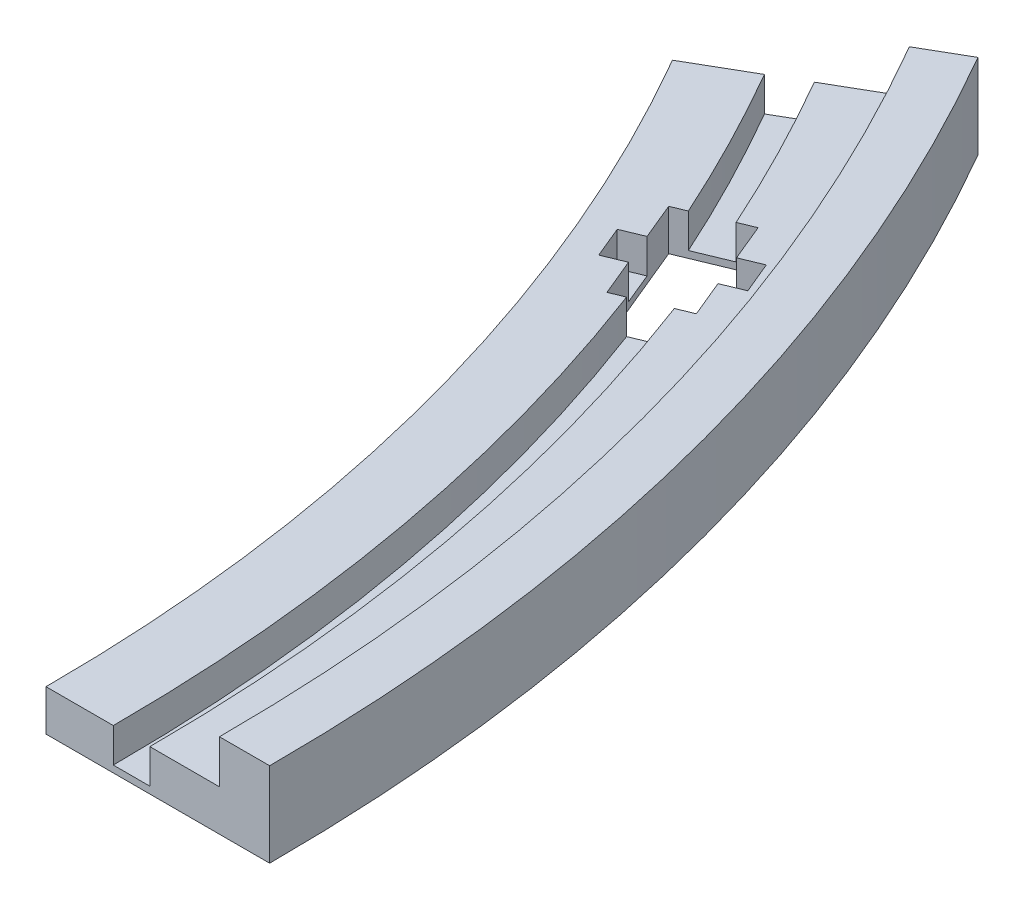
from build123d import *

# Parameters (mm, degrees)
AUFSATZ_LINEAR_AUSTRAGEN1_DEPTH = 3.6
SCHNITT_LINEAR_AUSTRAGEN1_DEPTH = 3
SCHNITT_LINEAR_AUSTRAGEN2_DEPTH = 190.652735282
SCHNITT_LINEAR_AUSTRAGEN3_DEPTH = 3
AUFSATZ_LINEAR_AUSTRAGEN2_DEPTH = 3.8


with BuildPart() as part:
    # Skizze1 → Aufsatz-Linear austragen1 (new body)
    with BuildSketch(Plane(origin=(0, 0, 0), x_dir=(1, 0, 0), z_dir=(0, 1, 0))):
        with BuildLine():
            Line((146.877908482, 84.8), (129.903810568, 75))
            ThreePointArc((129.903810568, 75), (144.888873943, 38.822856765), (150, 0))
            Line((150, 0), (169.6, 0))
            ThreePointArc((169.6, 0), (163.821020139, 43.895710049), (146.877908482, 84.8))
        make_face()
    extrude(amount=AUFSATZ_LINEAR_AUSTRAGEN1_DEPTH)

    # Skizze2 → Schnitt-Linear austragen1 (cut)
    with BuildSketch(Plane(origin=(0, 3.6, 0), x_dir=(1, 0, 0), z_dir=(0, 1, 0))):
        with BuildLine():
            Line((135.01336045, 77.95), (137.784641742, 79.55))
            ThreePointArc((137.784641742, 79.55), (153.678798963, 41.178110076), (159.1, 0))
            Line((159.1, 0), (155.9, 0))
            ThreePointArc((155.9, 0), (150.587836318, 40.349889131), (135.01336045, 77.95))
        make_face()
    extrude(amount=-SCHNITT_LINEAR_AUSTRAGEN1_DEPTH, mode=Mode.SUBTRACT)

    # Skizze3 → Schnitt-Linear austragen2 (cut, through all)
    with BuildSketch(Plane(origin=(0, 3.6, 0), x_dir=(1, 0, 0), z_dir=(0, 1, 0))):
        Polygon((140.825970611, 63.743987963), (146.369247806, 66.040088557), (150.19608213, 56.801293232), (144.652804935, 54.505192638), align=None)
    extrude(amount=-SCHNITT_LINEAR_AUSTRAGEN2_DEPTH, mode=Mode.SUBTRACT)

    # Skizze4 → Schnitt-Linear austragen3 (cut)
    with BuildSketch(Plane(origin=(0, 3.6, 0), x_dir=(1, 0, 0), z_dir=(0, 1, 0))):
        Polygon((140.317603559, 59.745042734), (149.556398885, 63.571877058), (150.704449182, 60.800238461), (141.465653857, 56.973404137), align=None)
    extrude(amount=-SCHNITT_LINEAR_AUSTRAGEN3_DEPTH, mode=Mode.SUBTRACT)

    # Skizze5 → Aufsatz-Linear austragen2 (add)
    with BuildSketch(Plane(origin=(0, 3.6, 0), x_dir=(1, 0, 0), z_dir=(0, 1, 0))):
        with BuildLine():
            Line((143.067396705, 82.6), (146.877908482, 84.8))
            ThreePointArc((146.877908482, 84.8), (163.821020139, 43.895710049), (169.6, 0))
            Line((169.6, 0), (165.2, 0))
            ThreePointArc((165.2, 0), (159.570946503, 42.756906251), (143.067396705, 82.6))
        make_face()
    extrude(amount=AUFSATZ_LINEAR_AUSTRAGEN2_DEPTH)


solid = part.part
